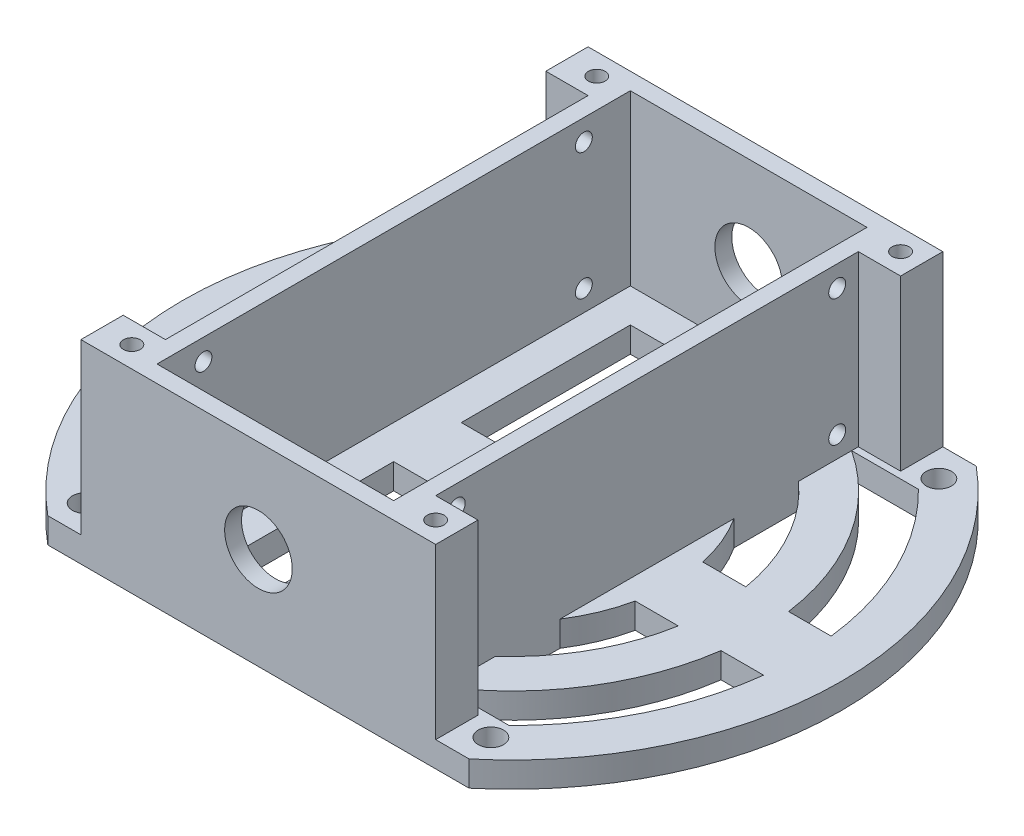
from build123d import *

# Parameters (mm, degrees)
CROQUIS2_R                 = 1.5
SALIENTE_EXTRUIR1_DEPTH    = 3
CROQUIS3_W                 = 1.97
CROQUIS3_H                 = 56
SALIENTE_EXTRUIR2_DEPTH    = 20
CROQUIS4_W                 = 4.999751321
CROQUIS4_H                 = 20
SALIENTE_EXTRUIR3_DEPTH    = 5
CROQUIS5_W                 = 5
CROQUIS5_H                 = 20
SALIENTE_EXTRUIR4_DEPTH    = 5
CROQUIS6_R                 = 1
CORTAR_EXTRUIR1_DEPTH      = 5
CROQUIS7_R                 = 1
CORTAR_EXTRUIR2_DEPTH      = 67.738294854
CROQUIS8_R                 = 1
CORTAR_EXTRUIR3_DEPTH      = 67.713573581
CROQUIS9_W                 = 6
CROQUIS9_H                 = 20
CORTAR_EXTRUIR5_DEPTH      = 10
CORTAR_EXTRUIR6_DEPTH      = 76.166481892
CORTAR_EXTRUIR6_DEPTH_BACK = 76.166481892
CROQUIS10_R                = 4


with BuildPart() as part:
    # Croquis2 → Saliente-Extruir1 (new body)
    with BuildSketch(Plane(origin=(0, 0, 0), x_dir=(1, 0, 0), z_dir=(0, 1, 0))):
        with BuildLine():
            Line((-24.919871589, 30), (24.919871589, 30))
            ThreePointArc((24.919871589, 30), (39, 0), (24.919871589, -30))
            Line((24.919871589, -30), (-24.919871589, -30))
            ThreePointArc((-24.919871589, -30), (-39, 0), (-24.919871589, 30))
        make_face()
        with Locations(Location((-24, 26.5, 0), (0, 0, 270))):
            Circle(CROQUIS2_R, mode=Mode.SUBTRACT)
        with Locations(Location((24, 26.5, 0), (0, 0, 90))):
            Circle(CROQUIS2_R, mode=Mode.SUBTRACT)
        with Locations(Location((-24, -26.5, 0), (0, 0, 90))):
            Circle(CROQUIS2_R, mode=Mode.SUBTRACT)
        with Locations(Location((24, -26.5, 0), (0, 0, 270))):
            Circle(CROQUIS2_R, mode=Mode.SUBTRACT)
    extrude(amount=SALIENTE_EXTRUIR1_DEPTH)

    # Croquis3 → Saliente-Extruir2 (add)
    with BuildSketch(Plane(origin=(0, 3, 0), x_dir=(1, 0, 0), z_dir=(0, 1, 0))):
        Polygon((-16, 28), (-16, -28), (-14, -28), (-14, 0), (-14, 28), align=None)
        with Locations((14.985, 0)):
            Rectangle(CROQUIS3_W, CROQUIS3_H)
        Polygon((-16, 28), (-14, 28), (0, 28), (14, 28), (15.97, 28), (15.97, 30), (-16, 30), align=None)
        Polygon((14, -28), (-14, -28), (-16, -28), (-16, -30), (15.97, -30), (15.97, -28), align=None)
    extrude(amount=SALIENTE_EXTRUIR2_DEPTH)

    # Croquis4 → Saliente-Extruir3 (add)
    with BuildSketch(Plane(origin=(15.97, 0, 0), x_dir=(0, 0, -1), z_dir=(1, 0, 0))):
        with Locations((27.50012434, 13)):
            Rectangle(CROQUIS4_W, CROQUIS4_H)
        with Locations((-27.50012434, 13)):
            Rectangle(CROQUIS4_W, CROQUIS4_H)
    extrude(amount=SALIENTE_EXTRUIR3_DEPTH)

    # Croquis5 → Saliente-Extruir4 (add)
    with BuildSketch(Plane.ZY.offset(16)):
        with Locations((-27.5, 13)):
            Rectangle(CROQUIS5_W, CROQUIS5_H)
        with Locations((27.5, 13)):
            Rectangle(CROQUIS5_W, CROQUIS5_H)
    extrude(amount=SALIENTE_EXTRUIR4_DEPTH)

    # Croquis6 → Cortar-Extruir1 (cut)
    with BuildSketch(Plane(origin=(0, 23, 0), x_dir=(1, 0, 0), z_dir=(0, 1, 0))):
        with Locations(Location((18.47, -27.5, 0), (0, 0, 270))):
            Circle(CROQUIS6_R)
        with Locations(Location((18.47, 27.5, 0), (0, 0, 90))):
            Circle(CROQUIS6_R)
        with Locations(Location((-17.474298495, -27.5, 0), (0, 0, 90))):
            Circle(CROQUIS6_R)
        with Locations(Location((-17.474298495, 27.5, 0), (0, 0, 270))):
            Circle(CROQUIS6_R)
    extrude(amount=-CORTAR_EXTRUIR1_DEPTH, mode=Mode.SUBTRACT)

    # Croquis7 → Cortar-Extruir2 (cut, through all)
    with BuildSketch(Plane.ZY.offset(16)):
        with Locations((-22.5, 5.5)):
            Circle(CROQUIS7_R)
        with Locations((22.5, 5.5)):
            Circle(CROQUIS7_R)
    extrude(amount=-CORTAR_EXTRUIR2_DEPTH, mode=Mode.SUBTRACT)

    # Croquis8 → Cortar-Extruir3 (cut, through all)
    with BuildSketch(Plane(origin=(15.97, 0, 0), x_dir=(0, 0, -1), z_dir=(1, 0, 0))):
        with Locations((22.500248679, 20.5)):
            Circle(CROQUIS8_R)
        with Locations((-22.500248679, 20.5)):
            Circle(CROQUIS8_R)
    extrude(amount=-CORTAR_EXTRUIR3_DEPTH, mode=Mode.SUBTRACT)

    # Croquis9 → Cortar-Extruir5 (cut)
    with BuildSketch(Plane(origin=(0, 3, 0), x_dir=(1, 0, 0), z_dir=(0, 1, 0))):
        with BuildLine():
            Line((15.97, 10.29364367), (15.97, 17.915331423))
            ThreePointArc((15.97, 17.915331423), (21.003069429, 11.613400646), (23.664319132, 4))
            Line((23.664319132, 4), (18.574175621, 4))
            ThreePointArc((18.574175621, 4), (17.556409228, 7.264467978), (15.97, 10.29364367))
        make_face()
        with BuildLine():
            Line((15.97, -10.29364367), (15.97, -17.915331423))
            ThreePointArc((15.97, -17.915331423), (21.003069429, -11.613400646), (23.664319132, -4))
            Line((23.664319132, -4), (18.574175621, -4))
            ThreePointArc((18.574175621, -4), (17.556409228, -7.264467978), (15.97, -10.29364367))
        make_face()
        with BuildLine():
            Line((15.97, 24.206592077), (23.875529314, 24.206592077))
            ThreePointArc((23.875529314, 24.206592077), (30.539353975, 14.944827159), (33.763886032, 4))
            Line((33.763886032, 4), (28.722813233, 4))
            ThreePointArc((28.722813233, 4), (24.52424269, 15.47777505), (15.97, 24.206592077))
        make_face()
        with BuildLine():
            Line((15.97, -24.206592077), (23.875529314, -24.206592077))
            ThreePointArc((23.875529314, -24.206592077), (30.539353975, -14.944827159), (33.763886032, -4))
            Line((33.763886032, -4), (28.722813233, -4))
            ThreePointArc((28.722813233, -4), (24.52424269, -15.47777505), (15.97, -24.206592077))
        make_face()
        with BuildLine():
            Line((-15.97, -10.29364367), (-15.97, -17.915331423))
            ThreePointArc((-15.97, -17.915331423), (-21.003069429, -11.613400646), (-23.664319132, -4))
            Line((-23.664319132, -4), (-18.574175621, -4))
            ThreePointArc((-18.574175621, -4), (-17.556409228, -7.264467978), (-15.97, -10.29364367))
        make_face()
        with BuildLine():
            Line((-15.97, 10.29364367), (-15.97, 17.915331423))
            ThreePointArc((-15.97, 17.915331423), (-21.003069429, 11.613400646), (-23.664319132, 4))
            Line((-23.664319132, 4), (-18.574175621, 4))
            ThreePointArc((-18.574175621, 4), (-17.556409228, 7.264467978), (-15.97, 10.29364367))
        make_face()
        with BuildLine():
            Line((-15.97, 24.206592077), (-23.875529314, 24.206592077))
            ThreePointArc((-23.875529314, 24.206592077), (-30.539353975, 14.944827159), (-33.763886032, 4))
            Line((-33.763886032, 4), (-28.722813233, 4))
            ThreePointArc((-28.722813233, 4), (-24.52424269, 15.47777505), (-15.97, 24.206592077))
        make_face()
        with BuildLine():
            Line((-15.97, -24.206592077), (-23.875529314, -24.206592077))
            ThreePointArc((-23.875529314, -24.206592077), (-30.539353975, -14.944827159), (-33.763886032, -4))
            Line((-33.763886032, -4), (-28.722813233, -4))
            ThreePointArc((-28.722813233, -4), (-24.52424269, -15.47777505), (-15.97, -24.206592077))
        make_face()
        with Locations((-7, 14)):
            Rectangle(CROQUIS9_W, CROQUIS9_H)
        with Locations((7, 14)):
            Rectangle(CROQUIS9_W, CROQUIS9_H)
        with Locations((7, -14)):
            Rectangle(CROQUIS9_W, CROQUIS9_H)
        with Locations((-7, -14)):
            Rectangle(CROQUIS9_W, CROQUIS9_H)
    extrude(amount=-CORTAR_EXTRUIR5_DEPTH, mode=Mode.SUBTRACT)

    # Croquis10 → Cortar-Extruir6 (cut, two sides: drawn at the far end of the back side and taken through both)
    with BuildSketch(Plane.XY.offset(30).offset(-CORTAR_EXTRUIR6_DEPTH_BACK)):
        with Locations((0, 12)):
            Circle(CROQUIS10_R)
    extrude(amount=CORTAR_EXTRUIR6_DEPTH + CORTAR_EXTRUIR6_DEPTH_BACK, mode=Mode.SUBTRACT)


solid = part.part
